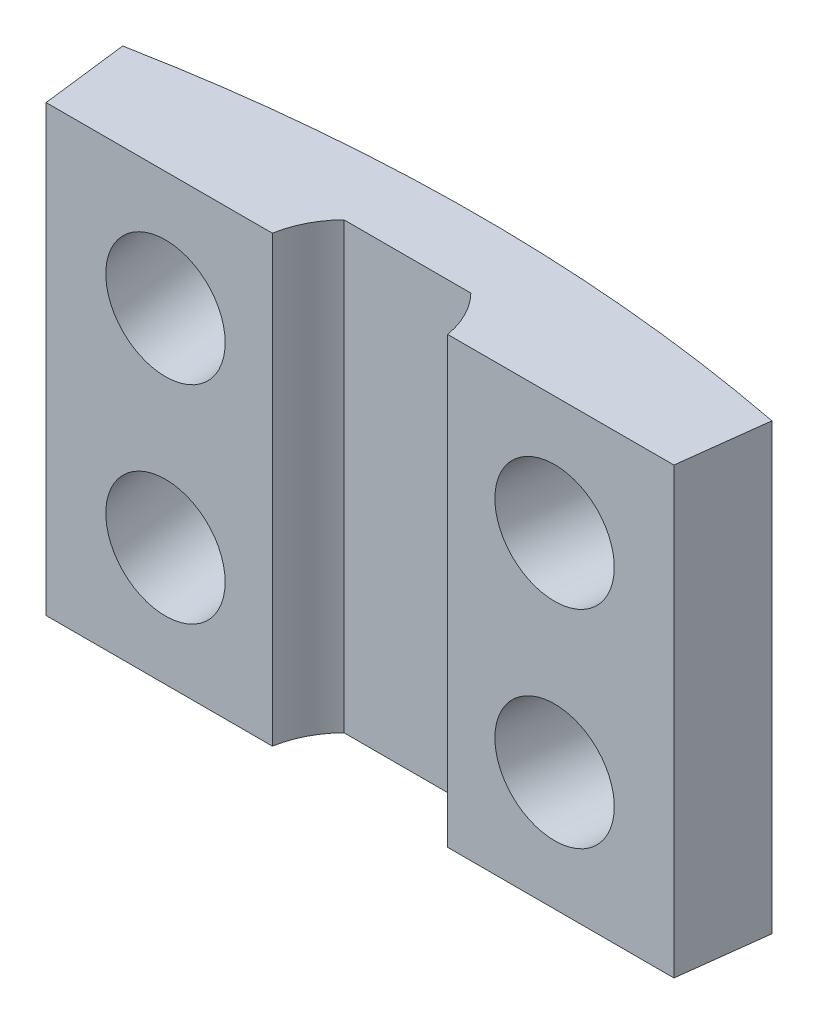
from build123d import *

# Parameters (mm, degrees)
EXTRUDE_1_DEPTH     = 15
SKETCH_5_R          = 2
CUT_EXTRUDE_6_DEPTH = 85
SKETCH_6_R          = 2
CUT_EXTRUDE_7_DEPTH = 85


with BuildPart() as part:
    # 草图1 → 凸台-拉伸1 (new body)
    with BuildSketch(Plane(origin=(0, 0, 0), x_dir=(1, 0, 0), z_dir=(0, 1, 0))):
        with BuildLine():
            Line((-2.142428529, 55.1), (2.142428529, 55.1))
            ThreePointArc((2.142428529, 55.1), (2.672769075, 54.362463017), (2.958039892, 53.5))
            Line((2.958039892, 53.5), (10.59901331, 53.5))
            Line((10.59901331, 53.5), (10.960695554, 56.445665493))
            ThreePointArc((10.960695554, 56.445665493), (0, 57.5), (-10.960695554, 56.445665493))
            Line((-10.960695554, 56.445665493), (-10.59901331, 53.5))
            Line((-10.59901331, 53.5), (-2.958039892, 53.5))
            ThreePointArc((-2.958039892, 53.5), (-2.672769075, 54.362463017), (-2.142428529, 55.1))
        make_face()
    extrude(amount=EXTRUDE_1_DEPTH)

    # 草图5 → 切除-拉伸6 (cut)
    with BuildSketch(Plane(origin=(0, 0, 0), x_dir=(-0.9925461516413212, 0, 0.12186934340515458), z_dir=(-0.12186934340515458, 0, -0.9925461516413212))):
        with Locations(Location((0, 11, 0), (0, 0, 180))):
            Circle(SKETCH_5_R)
        with Locations(Location((0, 4, 0), (0, 0, 180))):
            Circle(SKETCH_5_R)
    extrude(amount=CUT_EXTRUDE_6_DEPTH, mode=Mode.SUBTRACT)

    # 草图6 → 切除-拉伸7 (cut)
    with BuildSketch(Plane(origin=(0, 0, 0), x_dir=(0.992546151641322, 0, 0.12186934340514766), z_dir=(-0.12186934340514766, 0, 0.992546151641322))):
        with Locations((0, 11)):
            Circle(SKETCH_6_R)
        with Locations((0, 4)):
            Circle(SKETCH_6_R)
    extrude(amount=-CUT_EXTRUDE_7_DEPTH, mode=Mode.SUBTRACT)


solid = part.part
